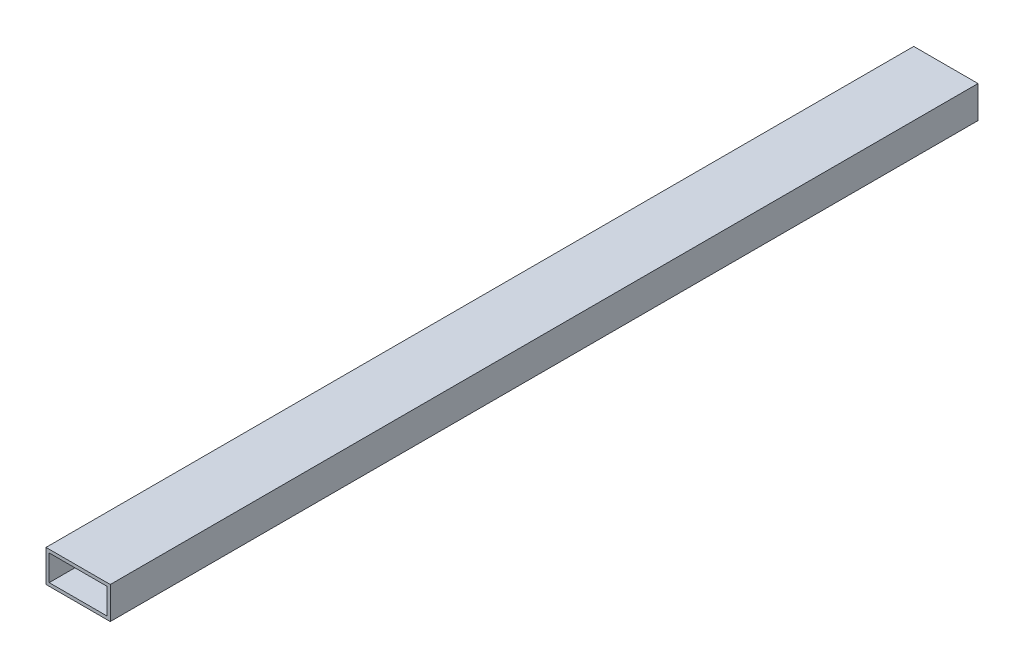
from build123d import *

# Parameters (mm, degrees)
SKETCH1_W           = 20
SKETCH1_H           = 10
SKETCH1_W_2         = 18
SKETCH1_H_2         = 8
BOSS_EXTRUDE1_DEPTH = 270


with BuildPart() as part:
    # Sketch1 → Boss-Extrude1 (new body)
    with BuildSketch(Plane.XY):
        Rectangle(SKETCH1_W, SKETCH1_H)
        Rectangle(SKETCH1_W_2, SKETCH1_H_2, mode=Mode.SUBTRACT)
    extrude(amount=BOSS_EXTRUDE1_DEPTH)


solid = part.part
